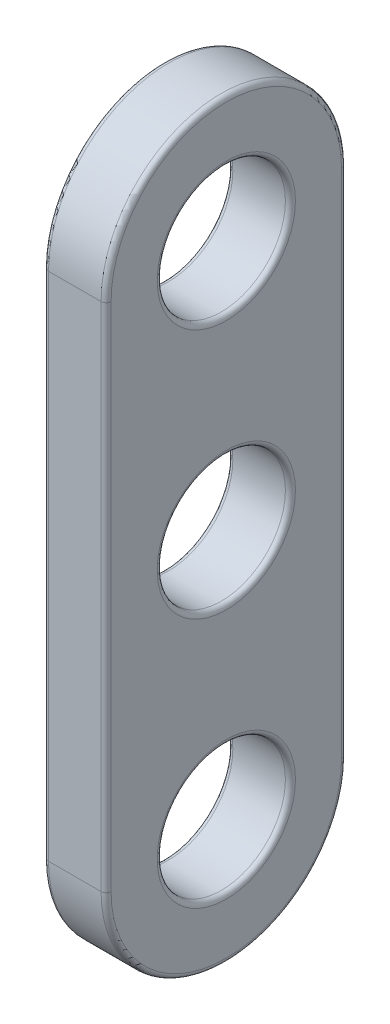
from build123d import *

# Parameters (mm, degrees)
SKETCH1_W           = 12.192
SKETCH1_H           = 38.1
SKETCH1_R           = 3.2512
BOSS_EXTRUDE1_DEPTH = 1.5875
FILLET1_RADIUS      = 6.096
FILLET1_LENGTH      = 3.175
FILLET2_RADIUS      = 6.096
FILLET2_LENGTH      = 3.175
SKETCH2_R           = 3.2512
CUT_EXTRUDE1_DEPTH  = 21.252020665
FILLET3_R           = 0.254


with BuildPart() as part:
    # Sketch1 → Boss-Extrude1 (new, symmetric)
    with BuildSketch(Plane(origin=(0, 0, 0), x_dir=(0, 0, -1), z_dir=(1, 0, 0))):
        Rectangle(SKETCH1_W, SKETCH1_H)
        with Locations((0, 12.7)):
            Circle(SKETCH1_R, mode=Mode.SUBTRACT)
        with Locations((0, -12.7)):
            Circle(SKETCH1_R, mode=Mode.SUBTRACT)
    extrude(amount=BOSS_EXTRUDE1_DEPTH, both=True)

    # Fillet1: full round fillet: the end face becomes a half cylinder, R = half its width
    fillet1_face = Plane((0, 19.05, 0), x_dir=(1, 0, 0), z_dir=(0, 1, 0))  # on the end face: x along it, z out of the body
    fillet1_slab = fillet1_face.offset(-FILLET1_RADIUS / 2) * Box(FILLET1_LENGTH, 2 * FILLET1_RADIUS, FILLET1_RADIUS, mode=Mode.PRIVATE)  # the body's end, R deep
    fillet1_round = Plane((0, 12.954, 0), x_dir=(0, 1, 0), z_dir=(1, 0, 0)) * Cylinder(FILLET1_RADIUS, FILLET1_LENGTH, mode=Mode.PRIVATE)  # its axis R under the face
    add(fillet1_slab - fillet1_round, mode=Mode.SUBTRACT)

    # Fillet2: full round fillet: the end face becomes a half cylinder, R = half its width
    fillet2_face = Plane((0, -19.05, 0), x_dir=(1, 0, 0), z_dir=(0, -1, 0))  # on the end face: x along it, z out of the body
    fillet2_slab = fillet2_face.offset(-FILLET2_RADIUS / 2) * Box(FILLET2_LENGTH, 2 * FILLET2_RADIUS, FILLET2_RADIUS, mode=Mode.PRIVATE)  # the body's end, R deep
    fillet2_round = Plane((0, -12.954, 0), x_dir=(0, -1, 0), z_dir=(1, 0, 0)) * Cylinder(FILLET2_RADIUS, FILLET2_LENGTH, mode=Mode.PRIVATE)  # its axis R under the face
    add(fillet2_slab - fillet2_round, mode=Mode.SUBTRACT)

    # Sketch2 → Cut-Extrude1 (cut, through all)
    with BuildSketch(Plane(origin=(1.5875, 0, 0), x_dir=(0, 0, -1), z_dir=(1, 0, 0))):
        Circle(SKETCH2_R)
    extrude(amount=-CUT_EXTRUDE1_DEPTH, mode=Mode.SUBTRACT)

    # Fillet3
    fillet3_edges = [part.edges().sort_by_distance(p)[0] for p in [
        (-1.5875, 12.7, 3.2512),
        (1.5875, 12.7, 3.2512),
        (-1.5875, -12.7, 3.2512),
        (1.5875, -12.7, 3.2512),
        (-1.5875, 0, 6.096),
        (1.5875, 0, 6.096),
        (1.5875, 19.05, 0),
        (-1.5875, 19.05, 0),
        (-1.5875, 0, -6.096),
        (1.5875, 0, -6.096),
        (-1.5875, -19.05, 0),
        (1.5875, -19.05, 0),
        (-1.5875, 0, 3.2512),
        (1.5875, 0, 3.2512),
    ]]
    fillet(fillet3_edges, radius=FILLET3_R)


solid = part.part
